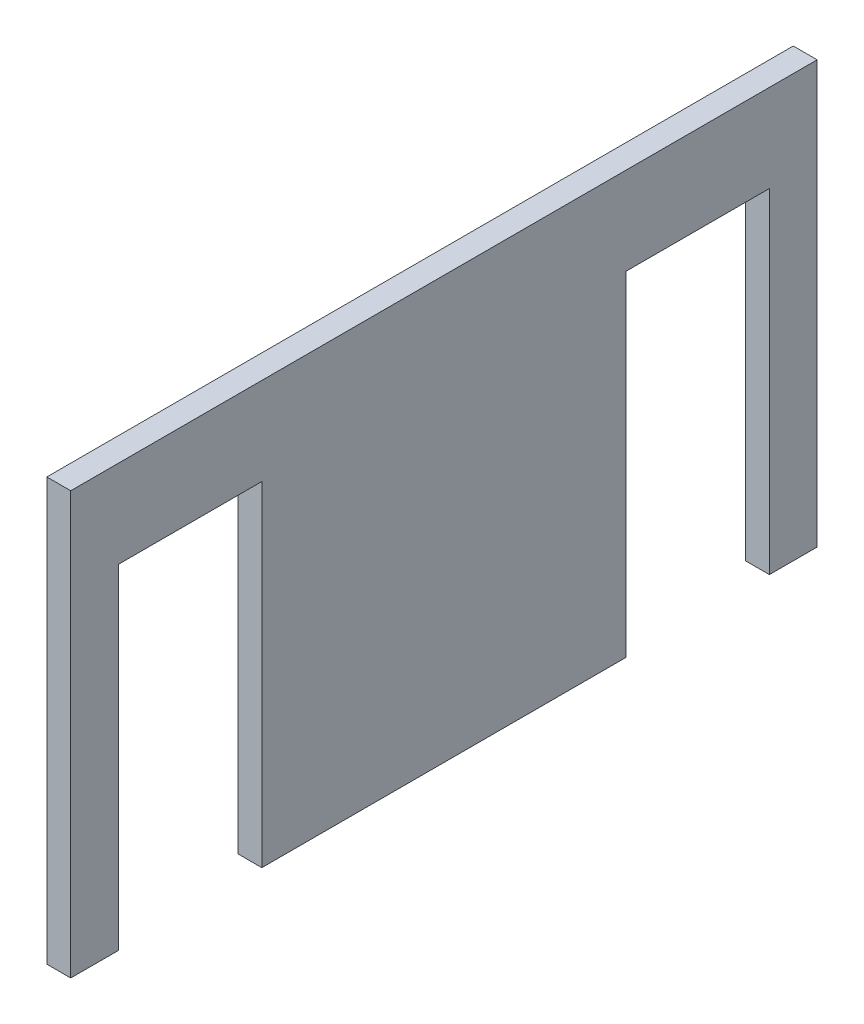
from build123d import *

# Parameters (mm, degrees)
SKETCH1_W           = 152.4
SKETCH1_H           = 4762.5
BOSS_EXTRUDE1_DEPTH = 2692.4
SKETCH2_W           = 914.4
SKETCH2_H           = 2133.6
CUT_EXTRUDE1_DEPTH  = 3598.581838194


with BuildPart() as part:
    # Sketch1 → Boss-Extrude1 (new body)
    with BuildSketch(Plane(origin=(0, 0, 0), x_dir=(1, 0, 0), z_dir=(0, 1, 0))):
        Rectangle(SKETCH1_W, SKETCH1_H)
    extrude(amount=BOSS_EXTRUDE1_DEPTH)

    # Sketch2 → Cut-Extrude1 (cut, through all)
    with BuildSketch(Plane(origin=(76.2, 0, 0), x_dir=(0, 0, -1), z_dir=(1, 0, 0))):
        with Locations((-1619.25, 1066.8)):
            Rectangle(SKETCH2_W, SKETCH2_H)
    cut_extrude1 = extrude(amount=-CUT_EXTRUDE1_DEPTH, mode=Mode.SUBTRACT)

    # Mirror1: Cut-Extrude1 across plane
    add(cut_extrude1.mirror(Plane.XY), mode=Mode.SUBTRACT)


solid = part.part
